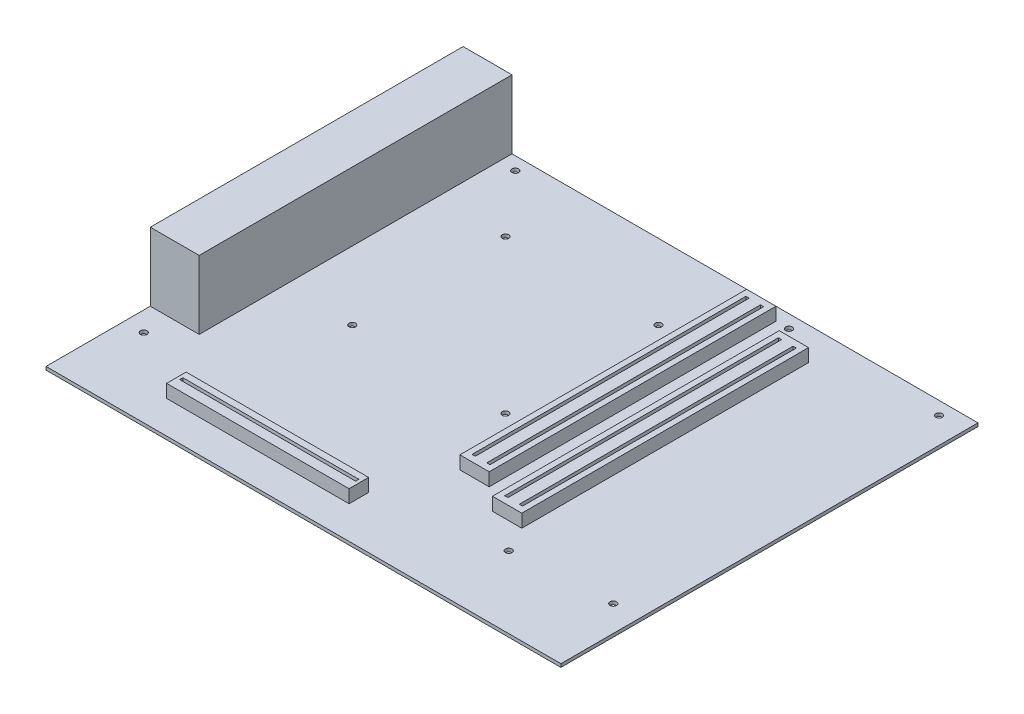
from build123d import *

# Parameters (mm, degrees)
SKETCH1_W           = 250.825
SKETCH1_H           = 203.2
SKETCH1_R           = 1.5875
BOSS_EXTRUDE1_DEPTH = 1.5875
SKETCH2_W           = 14.2875
SKETCH2_H           = 139.7
SKETCH2_W_2         = 1.5875
SKETCH2_H_2         = 133.35
SKETCH2_W_3         = 88.9
SKETCH2_H_3         = 9.525
SKETCH2_W_4         = 85.725
SKETCH2_H_4         = 1.5875
BOSS_EXTRUDE2_DEPTH = 6.35
SKETCH3_W           = 23.821163823
SKETCH3_H           = 152.4
BOSS_EXTRUDE3_DEPTH = 33.3375


with BuildPart() as part:
    # Sketch1 → Boss-Extrude1 (new body)
    with BuildSketch(Plane(origin=(0, 0, 0), x_dir=(1, 0, 0), z_dir=(0, 1, 0))):
        with Locations((125.4125, 101.6)):
            Rectangle(SKETCH1_W, SKETCH1_H)
        with Locations(Location((31.75, 196.85, 0), (0, 0, 270))):
            Circle(SKETCH1_R, mode=Mode.SUBTRACT)
        with Locations(Location((165.1, 196.85, 0), (0, 0, 270))):
            Circle(SKETCH1_R, mode=Mode.SUBTRACT)
        with Locations(Location((238.252, 196.85, 0), (0, 0, 270))):
            Circle(SKETCH1_R, mode=Mode.SUBTRACT)
        with Locations(Location((238.252, 38.1, 0), (0, 0, 270))):
            Circle(SKETCH1_R, mode=Mode.SUBTRACT)
        with Locations(Location((190.5, 34.925, 0), (0, 0, 270))):
            Circle(SKETCH1_R, mode=Mode.SUBTRACT)
        with Locations(Location((9.525, 38.1, 0), (0, 0, 270))):
            Circle(SKETCH1_R, mode=Mode.SUBTRACT)
        with Locations(Location((57.15, 166.6875, 0), (0, 0, 270))):
            Circle(SKETCH1_R, mode=Mode.SUBTRACT)
        with Locations(Location((131.7625, 166.6875, 0), (0, 0, 270))):
            Circle(SKETCH1_R, mode=Mode.SUBTRACT)
        with Locations(Location((131.7625, 92.075, 0), (0, 0, 270))):
            Circle(SKETCH1_R, mode=Mode.SUBTRACT)
        with Locations(Location((57.15, 92.075, 0), (0, 0, 270))):
            Circle(SKETCH1_R, mode=Mode.SUBTRACT)
    extrude(amount=BOSS_EXTRUDE1_DEPTH)

    # Sketch2 → Boss-Extrude2 (add)
    # profile 1 of 3: a face of its own
    with BuildSketch(Plane(origin=(0, 1.5875, 0), x_dir=(1, 0, 0), z_dir=(0, 1, 0))):
        with Locations((151.60625, 127)):
            Rectangle(SKETCH2_W, SKETCH2_H)
        with Locations((148.034375, 127)):
            Rectangle(SKETCH2_W_2, SKETCH2_H_2, mode=Mode.SUBTRACT)
        with Locations((155.178125, 127)):
            Rectangle(SKETCH2_W_2, SKETCH2_H_2, mode=Mode.SUBTRACT)
    # profile 2 of 3: a face of its own
    with BuildSketch(Plane(origin=(0, 1.5875, 0), x_dir=(1, 0, 0), z_dir=(0, 1, 0))):
        with Locations((177.00625, 117.475)):
            Rectangle(SKETCH2_W, SKETCH2_H)
        with Locations((173.434375, 117.475)):
            Rectangle(SKETCH2_W_2, SKETCH2_H_2, mode=Mode.SUBTRACT)
        with Locations((180.578125, 117.475)):
            Rectangle(SKETCH2_W_2, SKETCH2_H_2, mode=Mode.SUBTRACT)
    # profile 3 of 3: a face of its own
    with BuildSketch(Plane(origin=(0, 1.5875, 0), x_dir=(1, 0, 0), z_dir=(0, 1, 0))):
        with Locations((87.3125, 20.6375)):
            Rectangle(SKETCH2_W_3, SKETCH2_H_3)
        with Locations((87.3125, 21.43125)):
            Rectangle(SKETCH2_W_4, SKETCH2_H_4, mode=Mode.SUBTRACT)
    extrude(amount=BOSS_EXTRUDE2_DEPTH)

    # Sketch3 → Boss-Extrude3 (add)
    with BuildSketch(Plane(origin=(0, 1.5875, 0), x_dir=(1, 0, 0), z_dir=(0, 1, 0))):
        with Locations((11.910581912, 127)):
            Rectangle(SKETCH3_W, SKETCH3_H)
    extrude(amount=BOSS_EXTRUDE3_DEPTH)


solid = part.part
